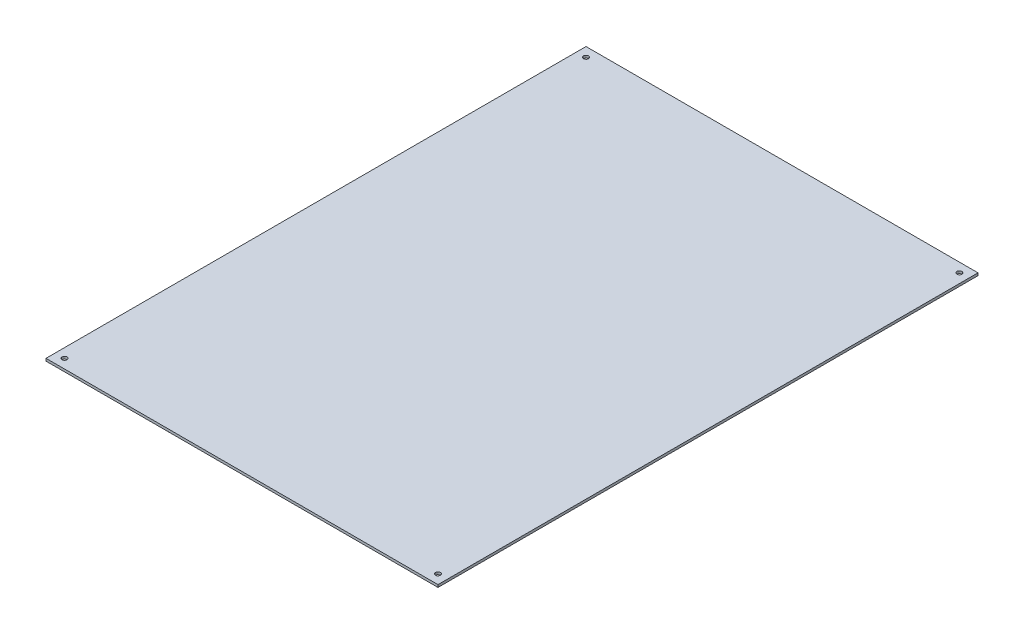
from build123d import *

# Parameters (mm, degrees)
SKETCH1_W           = 435
SKETCH1_H           = 2
BOSS_EXTRUDE1_DEPTH = 157.875
SKETCH3_R           = 2
CUT_EXTRUDE1_DEPTH  = 2


with BuildPart() as part:
    # Sketch1 → Boss-Extrude1 (new body)
    with BuildSketch(Plane(origin=(0, 0, 0), x_dir=(0, 0, -1), z_dir=(1, 0, 0))):
        with Locations((217.5, 1)):
            Rectangle(SKETCH1_W, SKETCH1_H)
    boss_extrude1 = extrude(amount=BOSS_EXTRUDE1_DEPTH)

    # Sketch3 → Cut-Extrude1 (cut)
    with BuildSketch(Plane(origin=(0, 2, 0), x_dir=(1, 0, 0), z_dir=(0, 1, 0))):
        with Locations(Location((150.375, 427.5, 0), (0, 0, 270))):
            Circle(SKETCH3_R)
        with Locations(Location((150.375, 7.5, 0), (0, 0, 270))):
            Circle(SKETCH3_R)
    cut_extrude1 = extrude(amount=-CUT_EXTRUDE1_DEPTH, mode=Mode.SUBTRACT)

    # Mirror1: Boss-Extrude1, Cut-Extrude1 across plane
    add(boss_extrude1.mirror(Plane(origin=(0, 0, 0), x_dir=(0, 0, 1), z_dir=(1, 0, 0))))
    add(cut_extrude1.mirror(Plane(origin=(0, 0, 0), x_dir=(0, 0, 1), z_dir=(1, 0, 0))), mode=Mode.SUBTRACT)


solid = part.part
